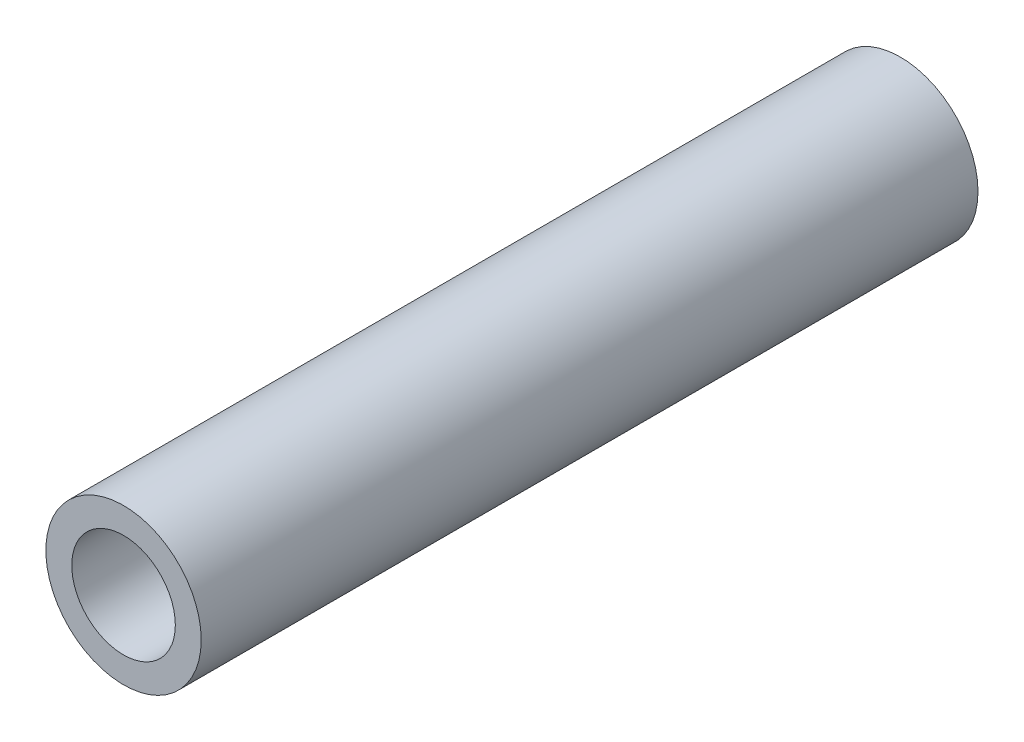
from build123d import *

# Parameters (mm, degrees)
SKETCH_1_R      = 3
SKETCH_1_R_2    = 2
EXTRUDE_1_DEPTH = 30


with BuildPart() as part:
    # ｽｹｯﾁ1 → ﾎﾞｽ - 押し出し1 (new body)
    with BuildSketch(Plane.XY):
        Circle(SKETCH_1_R)
        Circle(SKETCH_1_R_2, mode=Mode.SUBTRACT)
    extrude(amount=EXTRUDE_1_DEPTH)


solid = part.part
